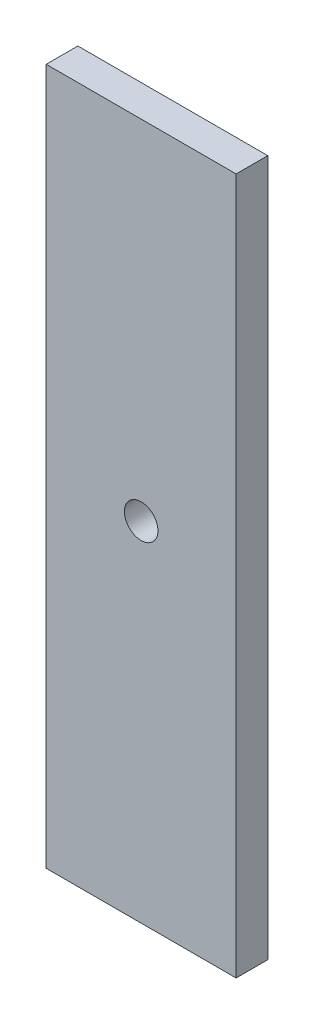
from build123d import *

# Parameters (mm, degrees)
SKETCH1_W           = 38.1
SKETCH1_H           = 139.7
SKETCH1_R           = 3.3655
BOSS_EXTRUDE1_DEPTH = 6.35


with BuildPart() as part:
    # Sketch1 → Boss-Extrude1 (new body)
    with BuildSketch(Plane.XY):
        Rectangle(SKETCH1_W, SKETCH1_H)
        Circle(SKETCH1_R, mode=Mode.SUBTRACT)
    extrude(amount=BOSS_EXTRUDE1_DEPTH)


solid = part.part
